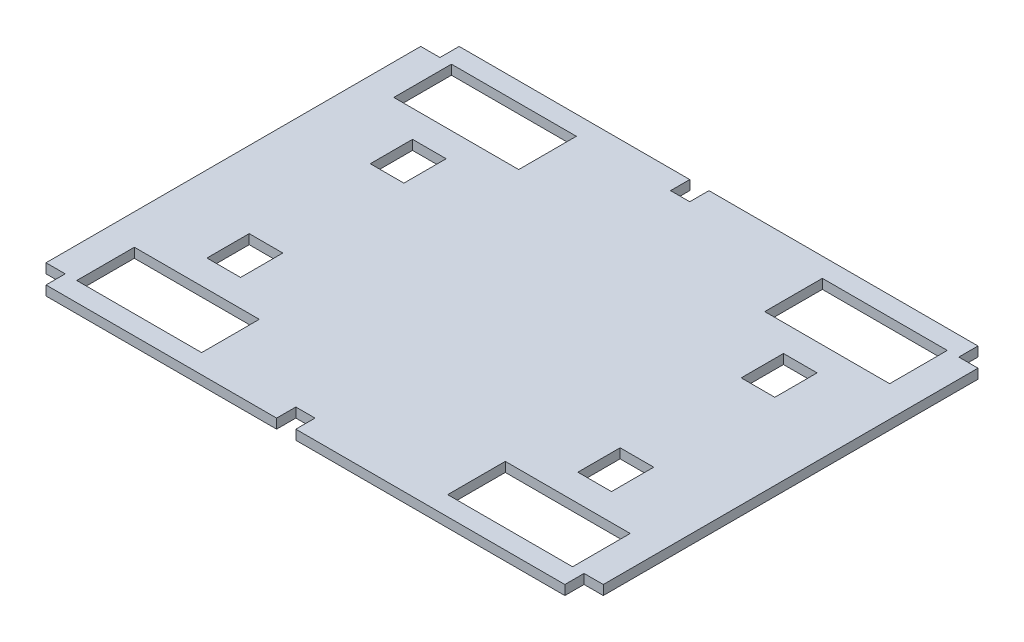
from build123d import *

# Parameters (mm, degrees)
SKETCH1_W           = 580
SKETCH1_H           = 430
SKETCH1_W_2         = 130
SKETCH1_H_2         = 60
SKETCH1_W_3         = 35
SKETCH1_H_3         = 44
BOSS_EXTRUDE1_DEPTH = 5
SKETCH2_W           = 20
SKETCH2_H           = 20
CUT_EXTRUDE1_DEPTH  = 10
SKETCH3_W           = 130
SKETCH3_H           = 60
SKETCH3_W_2         = 35
SKETCH3_H_2         = 44
CUT_EXTRUDE2_DEPTH  = 98
SKETCH4_W           = 20
SKETCH4_H           = 20
CUT_EXTRUDE3_DEPTH  = 98


with BuildPart() as part:
    # Sketch1 → Boss-Extrude1 (new, symmetric)
    with BuildSketch(Plane(origin=(0, 0, 0), x_dir=(1, 0, 0), z_dir=(0, 1, 0))):
        Rectangle(SKETCH1_W, SKETCH1_H)
        with Locations((-193.023255814, 165)):
            Rectangle(SKETCH1_W_2, SKETCH1_H_2, mode=Mode.SUBTRACT)
        with Locations((-193.023255814, -165)):
            Rectangle(SKETCH1_W_2, SKETCH1_H_2, mode=Mode.SUBTRACT)
        with Locations((-193.023255814, -85)):
            Rectangle(SKETCH1_W_3, SKETCH1_H_3, mode=Mode.SUBTRACT)
        with Locations((-193.023255814, 85)):
            Rectangle(SKETCH1_W_3, SKETCH1_H_3, mode=Mode.SUBTRACT)
    extrude(amount=BOSS_EXTRUDE1_DEPTH, both=True)

    # Sketch2 → Cut-Extrude1 (cut)
    with BuildSketch(Plane(origin=(0, 5, 0), x_dir=(1, 0, 0), z_dir=(0, 1, 0))):
        with Locations((-280, 205)):
            Rectangle(SKETCH2_W, SKETCH2_H)
        with Locations((280, 205)):
            Rectangle(SKETCH2_W, SKETCH2_H)
        with Locations((280, -205)):
            Rectangle(SKETCH2_W, SKETCH2_H)
        with Locations((-280, -205)):
            Rectangle(SKETCH2_W, SKETCH2_H)
    extrude(amount=-CUT_EXTRUDE1_DEPTH, mode=Mode.SUBTRACT)

    # Sketch3 → Cut-Extrude2 (cut)
    with BuildSketch(Plane(origin=(0, 5, 0), x_dir=(1, 0, 0), z_dir=(0, 1, 0))):
        with Locations((193.023255814, -165)):
            Rectangle(SKETCH3_W, SKETCH3_H)
        with Locations((-193.023255814, 165)):
            Rectangle(SKETCH3_W, SKETCH3_H)
        with Locations((193.023255814, -85)):
            Rectangle(SKETCH3_W_2, SKETCH3_H_2)
        with Locations((-193.023255814, 85)):
            Rectangle(SKETCH3_W_2, SKETCH3_H_2)
        with Locations((-193.023255814, -85)):
            Rectangle(SKETCH3_W_2, SKETCH3_H_2)
        with Locations((-193.023255814, -165)):
            Rectangle(SKETCH3_W, SKETCH3_H)
        with Locations((193.023255814, 85)):
            Rectangle(SKETCH3_W_2, SKETCH3_H_2)
        with Locations((193.023255814, 165)):
            Rectangle(SKETCH3_W, SKETCH3_H)
    extrude(amount=-CUT_EXTRUDE2_DEPTH, mode=Mode.SUBTRACT)

    # Sketch4 → Cut-Extrude3 (cut)
    with BuildSketch(Plane(origin=(0, 5, 0), x_dir=(1, 0, 0), z_dir=(0, 1, 0))):
        with Locations((-20, -205)):
            Rectangle(SKETCH4_W, SKETCH4_H)
        with Locations((-20, 205)):
            Rectangle(SKETCH4_W, SKETCH4_H)
    extrude(amount=-CUT_EXTRUDE3_DEPTH, mode=Mode.SUBTRACT)


solid = part.part
